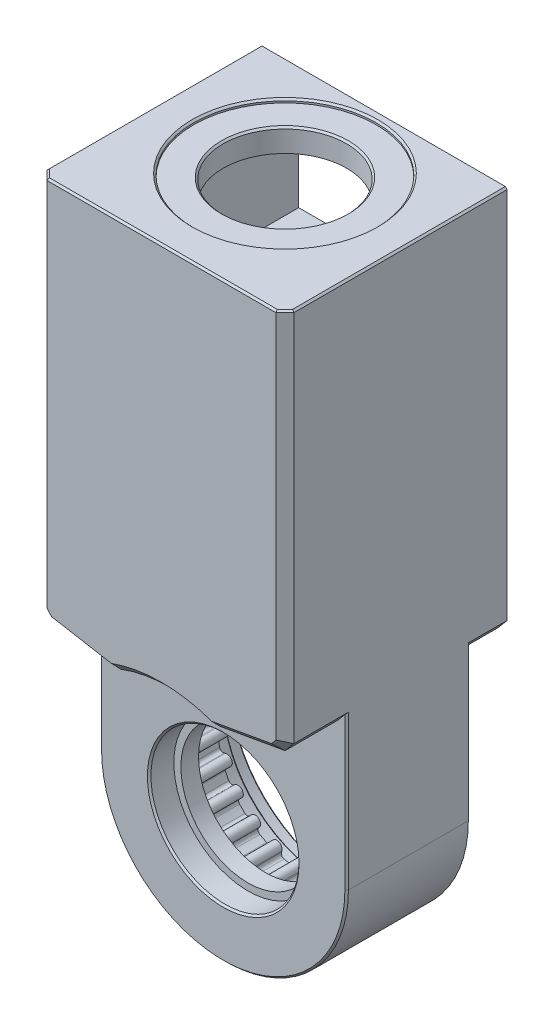
from build123d import *

# Parameters (mm, degrees)
SKIZZE1_W                       = 31.75
SKIZZE1_H                       = 17.5
SCHNITT_LINEAR_AUSTRAGEN1_DEPTH = 49.191026136
VERRUNDUNG1_R                   = 1
AUFSATZ_LINEAR_START            = 12
SKIZZE13_R                      = 31.75
SKIZZE13_R_2                    = 21
AUFSATZ_LINEAR_AUSTRAGEN1_DEPTH = 12
AUFSATZ_LINEAR_START_2          = -5
SKIZZE14_R                      = 21
SKIZZE14_R_2                    = 19
AUFSATZ_LINEAR_AUSTRAGEN2_DEPTH = 5
SKETCH3_R                       = 32.75
SKETCH3_R_2                     = 31.75
BOSS_EXTRUDE2_DEPTH             = 29.5
BOSS_EXTRUDE3_DEPTH             = 5.5
BOSS_EXTRUDE3_DEPTH_BACK        = 29.5
SKETCH4_R                       = 35
SKETCH4_R_2                     = 32.75
BOSS_EXTRUDE4_DEPTH             = 17.5
BOSS_EXTRUDE4_DEPTH_BACK        = 52.5
CUT_EXTRUDE2_DEPTH              = 158.955689989
CUT_EXTRUDE2_DEPTH_BACK         = 23.6
SKETCH7_W                       = 47.2
SKETCH7_H                       = 61
SKETCH7_W_2                     = 22.2
SKETCH7_H_2                     = 10
CUT_EXTRUDE3_START              = -7
CUT_EXTRUDE3_DEPTH              = 7
F_2_5MM_CHAMFER1_SIZE           = 2.5
F_0_5MM_CHAMFER2_SIZE           = 0.5


with BuildPart() as part:
    # Skizze1 → Rotation1 (revolve)
    with BuildSketch(Plane.XZ, mode=Mode.PRIVATE) as rotation1_sk:
        with Locations((15.875, 1.63167539)):
            Rectangle(SKIZZE1_W, SKIZZE1_H)
    revolve(rotation1_sk.sketch.rotate(Axis((0, 0, 10.38167539), (0, 0, -1)), 180), axis=Axis((0, 0, 10.38167539), (0, 0, -1)))

    # Skizze2 → Schnitt-Linear austragen1 (cut, through all)
    with BuildSketch(Plane.XY.offset(10.38167539)):
        with BuildLine():
            ThreePointArc((1.5, 22), (0, 20.5), (-1.5, 22))
            Line((-1.5, 22), (-1.5, 23.452078799))
            ThreePointArc((-1.5, 23.452078799), (-3.676209928, 23.210676004), (-5.820506128, 22.767777854))
            Line((-5.820506128, 22.767777854), (-5.371789102, 21.38676885))
            ThreePointArc((-5.371789102, 21.38676885), (-5.316841365, 21.157895056), (-5.298373876, 20.923243358))
            ThreePointArc((-5.298373876, 20.923243358), (-6.563722179, 19.441710848), (-8.224958651, 20.459717867))
            Line((-8.224958651, 20.459717867), (-8.673675677, 21.840726871))
            ThreePointArc((-8.673675677, 21.840726871), (-10.668776744, 20.938653318), (-12.571260562, 19.85480818))
            Line((-12.571260562, 19.85480818), (-11.717750059, 18.680051755))
            ThreePointArc((-11.717750059, 18.680051755), (-11.504690776, 18.261899368), (-11.43127555, 17.798373876))
            ThreePointArc((-11.43127555, 17.798373876), (-12.467750059, 16.371789102), (-14.144801042, 16.916695998))
            Line((-14.144801042, 16.916695998), (-14.998311545, 18.091452423))
            ThreePointArc((-14.998311545, 18.091452423), (-16.617009358, 16.617009358), (-18.091452423, 14.998311545))
            Line((-18.091452423, 14.998311545), (-16.916695998, 14.144801042))
            ThreePointArc((-16.916695998, 14.144801042), (-16.46186409, 13.6122613), (-16.298373876, 12.93127555))
            ThreePointArc((-16.298373876, 12.93127555), (-17.117388127, 11.594765764), (-18.680051755, 11.717750059))
            Line((-18.680051755, 11.717750059), (-19.85480818, 12.571260562))
            ThreePointArc((-19.85480818, 12.571260562), (-20.938653318, 10.668776744), (-21.840726871, 8.673675677))
            Line((-21.840726871, 8.673675677), (-20.459717867, 8.224958651))
            ThreePointArc((-20.459717867, 8.224958651), (-19.709717867, 7.680051755), (-19.423243358, 6.798373876))
            ThreePointArc((-19.423243358, 6.798373876), (-20.04156548, 5.584848385), (-21.38676885, 5.371789102))
            Line((-21.38676885, 5.371789102), (-22.767777854, 5.820506128))
            ThreePointArc((-22.767777854, 5.820506128), (-23.210676004, 3.676209928), (-23.452078799, 1.5))
            Line((-23.452078799, 1.5), (-22, 1.5))
            ThreePointArc((-22, 1.5), (-20.939339828, 1.060660172), (-20.5, 0))
            ThreePointArc((-20.5, 0), (-20.939339828, -1.060660172), (-22, -1.5))
            Line((-22, -1.5), (-23.452078799, -1.5))
            ThreePointArc((-23.452078799, -1.5), (-23.210676004, -3.676209928), (-22.767777854, -5.820506128))
            Line((-22.767777854, -5.820506128), (-21.38676885, -5.371789102))
            ThreePointArc((-21.38676885, -5.371789102), (-20.04156548, -5.584848385), (-19.423243358, -6.798373876))
            ThreePointArc((-19.423243358, -6.798373876), (-19.709717867, -7.680051755), (-20.459717867, -8.224958651))
            Line((-20.459717867, -8.224958651), (-21.840726871, -8.673675677))
            ThreePointArc((-21.840726871, -8.673675677), (-20.938653318, -10.668776744), (-19.85480818, -12.571260562))
            Line((-19.85480818, -12.571260562), (-18.680051755, -11.717750059))
            ThreePointArc((-18.680051755, -11.717750059), (-17.117388127, -11.594765764), (-16.298373876, -12.93127555))
            ThreePointArc((-16.298373876, -12.93127555), (-16.46186409, -13.6122613), (-16.916695998, -14.144801042))
            Line((-16.916695998, -14.144801042), (-18.091452423, -14.998311545))
            ThreePointArc((-18.091452423, -14.998311545), (-16.617009358, -16.617009358), (-14.998311545, -18.091452423))
            Line((-14.998311545, -18.091452423), (-14.144801042, -16.916695998))
            ThreePointArc((-14.144801042, -16.916695998), (-12.467750059, -16.371789102), (-11.43127555, -17.798373876))
            ThreePointArc((-11.43127555, -17.798373876), (-11.504690776, -18.261899368), (-11.717750059, -18.680051755))
            Line((-11.717750059, -18.680051755), (-12.571260562, -19.85480818))
            ThreePointArc((-12.571260562, -19.85480818), (-10.668776744, -20.938653318), (-8.673675677, -21.840726871))
            Line((-8.673675677, -21.840726871), (-8.224958651, -20.459717867))
            ThreePointArc((-8.224958651, -20.459717867), (-6.563722179, -19.441710848), (-5.298373876, -20.923243358))
            ThreePointArc((-5.298373876, -20.923243358), (-5.316841365, -21.157895056), (-5.371789102, -21.38676885))
            Line((-5.371789102, -21.38676885), (-5.820506128, -22.767777854))
            ThreePointArc((-5.820506128, -22.767777854), (-3.676209928, -23.210676004), (-1.5, -23.452078799))
            Line((-1.5, -23.452078799), (-1.5, -22))
            ThreePointArc((-1.5, -22), (0, -20.5), (1.5, -22))
            Line((1.5, -22), (1.5, -23.452078799))
            ThreePointArc((1.5, -23.452078799), (3.676209928, -23.210676004), (5.820506128, -22.767777854))
            Line((5.820506128, -22.767777854), (5.371789102, -21.38676885))
            ThreePointArc((5.371789102, -21.38676885), (6.334848385, -19.496658584), (8.224958651, -20.459717867))
            Line((8.224958651, -20.459717867), (8.673675677, -21.840726871))
            ThreePointArc((8.673675677, -21.840726871), (10.668776744, -20.938653318), (12.571260562, -19.85480818))
            Line((12.571260562, -19.85480818), (11.717750059, -18.680051755))
            ThreePointArc((11.717750059, -18.680051755), (12.049597672, -16.584848385), (14.144801042, -16.916695998))
            Line((14.144801042, -16.916695998), (14.998311545, -18.091452423))
            ThreePointArc((14.998311545, -18.091452423), (16.617009358, -16.617009358), (18.091452423, -14.998311545))
            Line((18.091452423, -14.998311545), (16.916695998, -14.144801042))
            ThreePointArc((16.916695998, -14.144801042), (16.584848385, -12.049597672), (18.680051755, -11.717750059))
            Line((18.680051755, -11.717750059), (19.85480818, -12.571260562))
            ThreePointArc((19.85480818, -12.571260562), (20.938653318, -10.668776744), (21.840726871, -8.673675677))
            Line((21.840726871, -8.673675677), (20.459717867, -8.224958651))
            ThreePointArc((20.459717867, -8.224958651), (19.496658584, -6.334848385), (21.38676885, -5.371789102))
            Line((21.38676885, -5.371789102), (22.767777854, -5.820506128))
            ThreePointArc((22.767777854, -5.820506128), (23.210676004, -3.676209928), (23.452078799, -1.5))
            Line((23.452078799, -1.5), (22, -1.5))
            ThreePointArc((22, -1.5), (20.5, 0), (22, 1.5))
            Line((22, 1.5), (23.452078799, 1.5))
            ThreePointArc((23.452078799, 1.5), (23.210676004, 3.676209928), (22.767777854, 5.820506128))
            Line((22.767777854, 5.820506128), (21.38676885, 5.371789102))
            ThreePointArc((21.38676885, 5.371789102), (19.496658584, 6.334848385), (20.459717867, 8.224958651))
            Line((20.459717867, 8.224958651), (21.840726871, 8.673675677))
            ThreePointArc((21.840726871, 8.673675677), (20.938653318, 10.668776744), (19.85480818, 12.571260562))
            Line((19.85480818, 12.571260562), (18.680051755, 11.717750059))
            ThreePointArc((18.680051755, 11.717750059), (16.584848385, 12.049597672), (16.916695998, 14.144801042))
            Line((16.916695998, 14.144801042), (18.091452423, 14.998311545))
            ThreePointArc((18.091452423, 14.998311545), (16.617009358, 16.617009358), (14.998311545, 18.091452423))
            Line((14.998311545, 18.091452423), (14.144801042, 16.916695998))
            ThreePointArc((14.144801042, 16.916695998), (12.049597672, 16.584848385), (11.717750059, 18.680051755))
            Line((11.717750059, 18.680051755), (12.571260562, 19.85480818))
            ThreePointArc((12.571260562, 19.85480818), (10.668776744, 20.938653318), (8.673675677, 21.840726871))
            Line((8.673675677, 21.840726871), (8.224958651, 20.459717867))
            ThreePointArc((8.224958651, 20.459717867), (6.334848385, 19.496658584), (5.371789102, 21.38676885))
            Line((5.371789102, 21.38676885), (5.820506128, 22.767777854))
            ThreePointArc((5.820506128, 22.767777854), (3.676209928, 23.210676004), (1.5, 23.452078799))
            Line((1.5, 23.452078799), (1.5, 22))
        make_face()
    extrude(amount=-SCHNITT_LINEAR_AUSTRAGEN1_DEPTH, mode=Mode.SUBTRACT)

    # Skizze3 → Schnitt-Rotation1 (revolve, cut)
    with BuildSketch(Plane(origin=(0, 0, 0), x_dir=(1, 0, 0), z_dir=(0, 1, 0))):
        Polygon((29, 7.11832461), (0, 7.11832461), (0, -0.38167539), (26.5, -0.38167539), (27, 0.11832461), (29, 0.11832461), align=None)
    revolve(axis=Axis((0, 0, -7.11832461), (0, 0, 1)), mode=Mode.SUBTRACT)

    # Verrundung1
    verrundung1_edges = [part.edges().sort_by_distance(p)[0] for p in [
        (-8.673675677, 21.840726871, 5.38167539),
        (-12.571260562, 19.85480818, 5.38167539),
        (-14.998311545, 18.091452423, 5.38167539),
        (-18.091452423, 14.998311545, 5.38167539),
        (-19.85480818, 12.571260562, 5.38167539),
        (-21.840726871, 8.673675677, 5.38167539),
        (-22.767777854, 5.820506128, 5.38167539),
        (-23.452078799, 1.5, 5.38167539),
        (-23.452078799, -1.5, 5.38167539),
        (-22.767777854, -5.820506128, 5.38167539),
        (-21.840726871, -8.673675677, 5.38167539),
        (-19.85480818, -12.571260562, 5.38167539),
        (-18.091452423, -14.998311545, 5.38167539),
        (-14.998311545, -18.091452423, 5.38167539),
        (-12.571260562, -19.85480818, 5.38167539),
        (-8.673675677, -21.840726871, 5.38167539),
        (-5.820506128, -22.767777854, 5.38167539),
        (-1.5, -23.452078799, 5.38167539),
        (1.5, -23.452078799, 5.38167539),
        (5.820506128, -22.767777854, 5.38167539),
        (8.673675677, -21.840726871, 5.38167539),
        (12.571260562, -19.85480818, 5.38167539),
        (14.998311545, -18.091452423, 5.38167539),
        (18.091452423, -14.998311545, 5.38167539),
        (19.85480818, -12.571260562, 5.38167539),
        (21.840726871, -8.673675677, 5.38167539),
        (22.767777854, -5.820506128, 5.38167539),
        (23.452078799, -1.5, 5.38167539),
        (23.452078799, 1.5, 5.38167539),
        (22.767777854, 5.820506128, 5.38167539),
        (21.840726871, 8.673675677, 5.38167539),
        (19.85480818, 12.571260562, 5.38167539),
        (18.091452423, 14.998311545, 5.38167539),
        (14.998311545, 18.091452423, 5.38167539),
        (12.571260562, 19.85480818, 5.38167539),
        (8.673675677, 21.840726871, 5.38167539),
        (5.820506128, 22.767777854, 5.38167539),
        (1.5, 23.452078799, 5.38167539),
        (-1.5, 23.452078799, 5.38167539),
        (-5.820506128, 22.767777854, 5.38167539),
    ]]
    fillet(verrundung1_edges, radius=VERRUNDUNG1_R)

    # Skizze13 → Aufsatz-Linear austragen1 (add)
    with BuildSketch(Plane.XY.offset(10.38167539).offset(AUFSATZ_LINEAR_START)):
        with Locations(Location((0, 0, 0), (0, 0, 180))):
            Circle(SKIZZE13_R)
        with Locations(Location((0, 0, 0), (0, 0, 182.980613219))):
            Circle(SKIZZE13_R_2, mode=Mode.SUBTRACT)
    extrude(amount=-AUFSATZ_LINEAR_AUSTRAGEN1_DEPTH)

    # Skizze14 → Aufsatz-Linear austragen2 (add)
    with BuildSketch(Plane(origin=(0, 0, 10.38167539), x_dir=(-1, 0, 0), z_dir=(0, 0, -1)).offset(AUFSATZ_LINEAR_START_2)):
        with Locations(Location((0, 0, 0), (0, 0, 180))):
            Circle(SKIZZE14_R)
        Circle(SKIZZE14_R_2, mode=Mode.SUBTRACT)
    extrude(amount=AUFSATZ_LINEAR_AUSTRAGEN2_DEPTH)

    # Sketch3 → Boss-Extrude2 (add, through all)
    with BuildSketch(Plane(origin=(0, 0, -7.11832461), x_dir=(-1, 0, 0), z_dir=(0, 0, -1))):
        Circle(SKETCH3_R)
        Circle(SKETCH3_R_2, mode=Mode.SUBTRACT)
    extrude(amount=-BOSS_EXTRUDE2_DEPTH)

    # Sketch4 → Boss-Extrude3 (add, two sides: drawn at the far end of the back side and taken through both)
    # profile 1 of 4: a face of its own
    with BuildSketch(Plane(origin=(0, 0, -7.11832461), x_dir=(-1, 0, 0), z_dir=(0, 0, -1)).offset(-BOSS_EXTRUDE3_DEPTH_BACK)):
        Circle(SKETCH4_R)
        Circle(SKETCH4_R_2, mode=Mode.SUBTRACT)
    # profile 2 of 4: a face of its own
    with BuildSketch(Plane(origin=(0, 0, -7.11832461), x_dir=(-1, 0, 0), z_dir=(0, 0, -1)).offset(-BOSS_EXTRUDE3_DEPTH_BACK)):
        with BuildLine():
            ThreePointArc((-32.75, 0), (0, 32.75), (32.75, 0))
            Line((32.75, 0), (35, 0))
            ThreePointArc((35, 0), (0, 35), (-35, 0))
            Line((-35, 0), (-32.75, 0))
        make_face()
    # profile 3 of 4: a face of its own
    with BuildSketch(Plane(origin=(0, 0, -7.11832461), x_dir=(-1, 0, 0), z_dir=(0, 0, -1)).offset(-BOSS_EXTRUDE3_DEPTH_BACK)):
        with BuildLine():
            Line((35, 0), (32.75, 0))
            ThreePointArc((32.75, 0), (0, -32.75), (-32.75, 0))
            Line((-32.75, 0), (-35, 0))
            ThreePointArc((-35, 0), (0, -35), (35, 0))
        make_face()
    # profile 4 of 4: a face of its own
    with BuildSketch(Plane(origin=(0, 0, -7.11832461), x_dir=(-1, 0, 0), z_dir=(0, 0, -1)).offset(-BOSS_EXTRUDE3_DEPTH_BACK)):
        with BuildLine():
            ThreePointArc((-35, 0), (0, 35), (35, 0))
            Line((35, 0), (35, 150))
            Line((35, 150), (-35, 150))
            Line((-35, 150), (-35, 0))
        make_face()
    extrude(amount=BOSS_EXTRUDE3_DEPTH + BOSS_EXTRUDE3_DEPTH_BACK)

    # Sketch5 → Boss-Extrude4 (add, two sides: drawn at the far end of the back side and taken through both)
    with BuildSketch(Plane(origin=(0, 0, -12.61832461), x_dir=(-1, 0, 0), z_dir=(0, 0, -1)).offset(-BOSS_EXTRUDE4_DEPTH_BACK)):
        with BuildLine():
            Line((-32.537980617, 40.737323881), (-14.002564118, 37.469029853))
            ThreePointArc((-14.002564118, 37.469029853), (0, 40), (14.002564118, 37.469029853))
            Line((14.002564118, 37.469029853), (32.537980617, 40.737323881))
            Line((32.537980617, 40.737323881), (35, 43.671444325))
            Line((35, 43.671444325), (35, 150))
            Line((35, 150), (-35, 150))
            Line((-35, 150), (-35, 43.671444325))
            Line((-35, 43.671444325), (-32.537980617, 40.737323881))
        make_face()
    extrude(amount=BOSS_EXTRUDE4_DEPTH + BOSS_EXTRUDE4_DEPTH_BACK)

    # Sketch7 → Cut-Extrude2 (cut, two sides: drawn at the far end of the back side and taken through both)
    with BuildSketch(Plane(origin=(0, 0, 4.88167539), x_dir=(-1, 0, 0), z_dir=(0, 0, -1)).offset(-CUT_EXTRUDE2_DEPTH_BACK)):
        with Locations((0, 75.5)):
            Rectangle(SKETCH7_W, SKETCH7_H)
        with Locations((0, 111)):
            Rectangle(SKETCH7_W_2, SKETCH7_H_2)
        Polygon((-23.6, 116), (-11.1, 116), (11.1, 116), (23.6, 116), (23.6, 140), (-23.6, 140), align=None)
    extrude(amount=CUT_EXTRUDE2_DEPTH + CUT_EXTRUDE2_DEPTH_BACK, mode=Mode.SUBTRACT)

    # Sketch10 → Cut-Revolve1 (revolve, cut)
    with BuildSketch(Plane.XY.offset(4.88167539), mode=Mode.PRIVATE) as cut_revolve1_sk:
        Polygon((25.85, 150), (0, 150), (0, 140), (21, 140), (21, 142), (19.5, 142), (19.5, 142.5), (17.5, 142.5), (17.5, 149), (25.85, 149), align=None)
    revolve(cut_revolve1_sk.sketch.rotate(Axis((0, 150, 4.88167539), (0, -1, 0)), 180), axis=Axis((0, 150, 4.88167539), (0, -1, 0)), mode=Mode.SUBTRACT)

    # Sketch11 → Cut-Extrude3 (cut)
    with BuildSketch(Plane(origin=(0, 0, -30.11832461), x_dir=(-1, 0, 0), z_dir=(0, 0, -1)).offset(CUT_EXTRUDE3_START)):
        with BuildLine():
            Line((14.002564118, 37.469029853), (32.537980617, 40.737323881))
            Line((32.537980617, 40.737323881), (35, 43.671444325))
            Line((35, 43.671444325), (35, 150))
            Line((35, 150), (-35, 150))
            Line((-35, 150), (-35, 43.671444325))
            Line((-35, 43.671444325), (-32.537980617, 40.737323881))
            Line((-32.537980617, 40.737323881), (-14.002564118, 37.469029853))
            ThreePointArc((-14.002564118, 37.469029853), (0, 40), (14.002564118, 37.469029853))
        make_face()
    extrude(amount=CUT_EXTRUDE3_DEPTH, mode=Mode.SUBTRACT)

    # 2,5mm Chamfer1
    f_2_5mm_chamfer1_edges = [part.edges().sort_by_distance(p)[0] for p in [
        (-23.270272368, 39.103176867, 39.88167539),
        (-33.768990309, 42.204384103, 39.88167539),
        (-35, 96.835722162, 39.88167539),
        (35, 96.835722162, 39.88167539),
        (0, 40, 39.88167539),
        (23.270272368, 39.103176867, 39.88167539),
        (33.768990309, 42.204384103, 39.88167539),
    ]]
    chamfer(f_2_5mm_chamfer1_edges, length=F_2_5MM_CHAMFER1_SIZE)

    # 0,5mm Chamfer2
    f_0_5mm_chamfer2_edges = [part.edges().sort_by_distance(p)[0] for p in [
        (35, 150, 7.13167539),
        (0, 150, 39.88167539),
        (-35, 150, 7.13167539),
        (-33.75, 150, 38.63167539),
        (33.75, 150, 38.63167539),
        (-29, 0, -7.11832461),
        (20.971590909, 1.09195913, 22.38167539),
        (0, -35, 22.38167539),
        (35, 21.835722162, -12.61832461),
        (32.75, 0, -12.61832461),
        (-35, 21.835722162, 22.38167539),
        (35, 21.835722162, 22.38167539),
        (0, -35, -12.61832461),
        (-35, 21.835722162, -12.61832461),
        (11.1, 106, 2.68167539),
        (11.1, 116, 2.68167539),
        (-11.1, 116, 2.68167539),
        (-11.1, 106, 2.68167539),
        (25.85, 150, 4.88167539),
        (21, 140, 4.88167539),
        (17.5, 149, 4.88167539),
        (-17.35, 106, -23.11832461),
        (-23.6, 128, -23.11832461),
        (0, 140, -23.11832461),
        (11.1, 111, -23.11832461),
        (17.35, 106, -23.11832461),
        (23.6, 75.5, -23.11832461),
        (-23.6, 75.5, -23.11832461),
        (0, 45, -23.11832461),
        (17.35, 116, -23.11832461),
        (23.6, 128, -23.11832461),
        (-17.35, 116, -23.11832461),
        (-11.1, 111, -23.11832461),
    ]]
    chamfer(f_0_5mm_chamfer2_edges, length=F_0_5MM_CHAMFER2_SIZE)


solid = part.part
